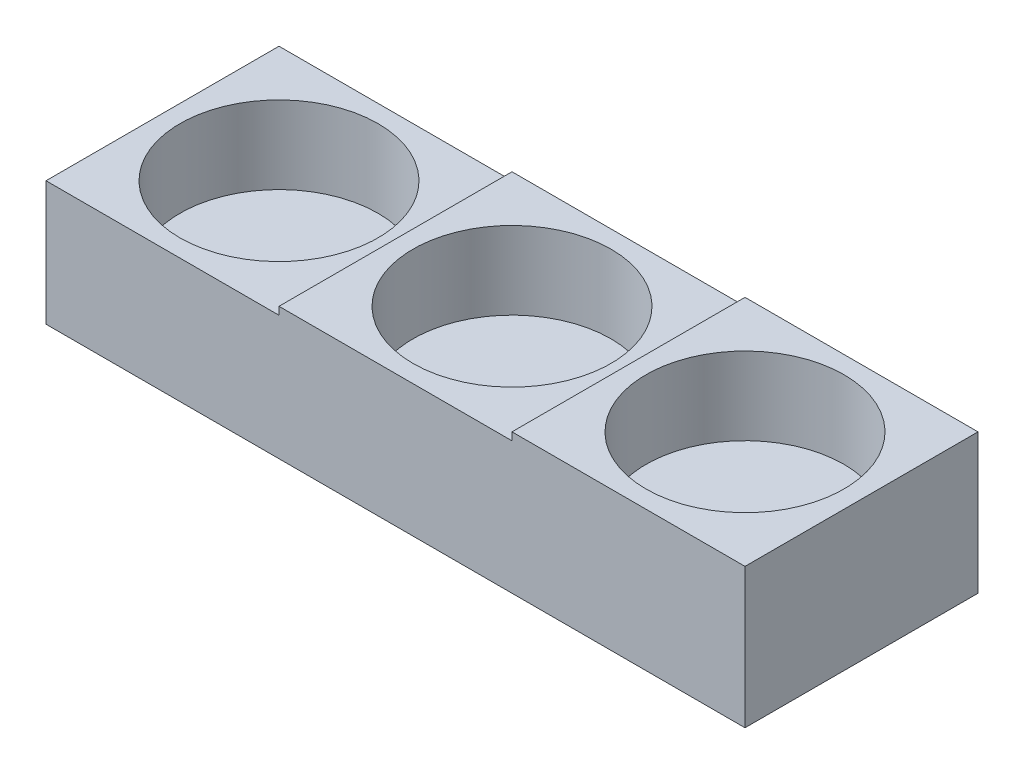
from build123d import *

# Parameters (mm, degrees)
SKETCH1_W           = 90
SKETCH1_H           = 30
SKETCH1_R           = 9
BOSS_EXTRUDE1_DEPTH = 5
SKETCH2_W           = 30
SKETCH2_H           = 30
BOSS_EXTRUDE2_DEPTH = 1
SKETCH3_W           = 30
SKETCH3_H           = 30
BOSS_EXTRUDE3_DEPTH = 2
SKETCH4_W           = 30
SKETCH4_H           = 30
BOSS_EXTRUDE4_DEPTH = 3
SKETCH5_W           = 30
SKETCH5_H           = 30
SKETCH5_R           = 12.75
BOSS_EXTRUDE5_DEPTH = 10
SKETCH6_W           = 30
SKETCH6_H           = 30
SKETCH6_R           = 12.75
BOSS_EXTRUDE6_DEPTH = 10
SKETCH7_W           = 30
SKETCH7_H           = 30
SKETCH7_R           = 12.75
BOSS_EXTRUDE7_DEPTH = 10


with BuildPart() as part:
    # Sketch1 → Boss-Extrude1 (new body)
    with BuildSketch(Plane(origin=(0, 0, 0), x_dir=(1, 0, 0), z_dir=(0, 1, 0))):
        Rectangle(SKETCH1_W, SKETCH1_H)
        with Locations(Location((-30, 0, 0), (0, 0, 270))):
            Circle(SKETCH1_R, mode=Mode.SUBTRACT)
        with Locations(Location((0, 0, 0), (0, 0, 270))):
            Circle(SKETCH1_R, mode=Mode.SUBTRACT)
        with Locations(Location((30, 0, 0), (0, 0, 270))):
            Circle(SKETCH1_R, mode=Mode.SUBTRACT)
    extrude(amount=BOSS_EXTRUDE1_DEPTH)

    # Sketch2 → Boss-Extrude2 (add)
    with BuildSketch(Plane(origin=(0, 5, 0), x_dir=(1, 0, 0), z_dir=(0, 1, 0))):
        with Locations((-30, 0)):
            Rectangle(SKETCH2_W, SKETCH2_H)
    extrude(amount=BOSS_EXTRUDE2_DEPTH)

    # Sketch3 → Boss-Extrude3 (add)
    with BuildSketch(Plane(origin=(0, 5, 0), x_dir=(1, 0, 0), z_dir=(0, 1, 0))):
        Rectangle(SKETCH3_W, SKETCH3_H)
    extrude(amount=BOSS_EXTRUDE3_DEPTH)

    # Sketch4 → Boss-Extrude4 (add)
    with BuildSketch(Plane(origin=(0, 5, 0), x_dir=(1, 0, 0), z_dir=(0, 1, 0))):
        with Locations((30, 0)):
            Rectangle(SKETCH4_W, SKETCH4_H)
    extrude(amount=BOSS_EXTRUDE4_DEPTH)

    # Sketch5 → Boss-Extrude5 (add)
    with BuildSketch(Plane(origin=(0, 6, 0), x_dir=(1, 0, 0), z_dir=(0, 1, 0))):
        with Locations((-30, 0)):
            Rectangle(SKETCH5_W, SKETCH5_H)
        with Locations(Location((-30, 0, 0), (0, 0, 270))):
            Circle(SKETCH5_R, mode=Mode.SUBTRACT)
    extrude(amount=BOSS_EXTRUDE5_DEPTH)

    # Sketch6 → Boss-Extrude6 (add)
    with BuildSketch(Plane(origin=(0, 7, 0), x_dir=(1, 0, 0), z_dir=(0, 1, 0))):
        Rectangle(SKETCH6_W, SKETCH6_H)
        with Locations(Location((0, 0, 0), (0, 0, 270))):
            Circle(SKETCH6_R, mode=Mode.SUBTRACT)
    extrude(amount=BOSS_EXTRUDE6_DEPTH)

    # Sketch7 → Boss-Extrude7 (add)
    with BuildSketch(Plane(origin=(0, 8, 0), x_dir=(1, 0, 0), z_dir=(0, 1, 0))):
        with Locations((30, 0)):
            Rectangle(SKETCH7_W, SKETCH7_H)
        with Locations(Location((30, 0, 0), (0, 0, 270))):
            Circle(SKETCH7_R, mode=Mode.SUBTRACT)
    extrude(amount=BOSS_EXTRUDE7_DEPTH)


solid = part.part
